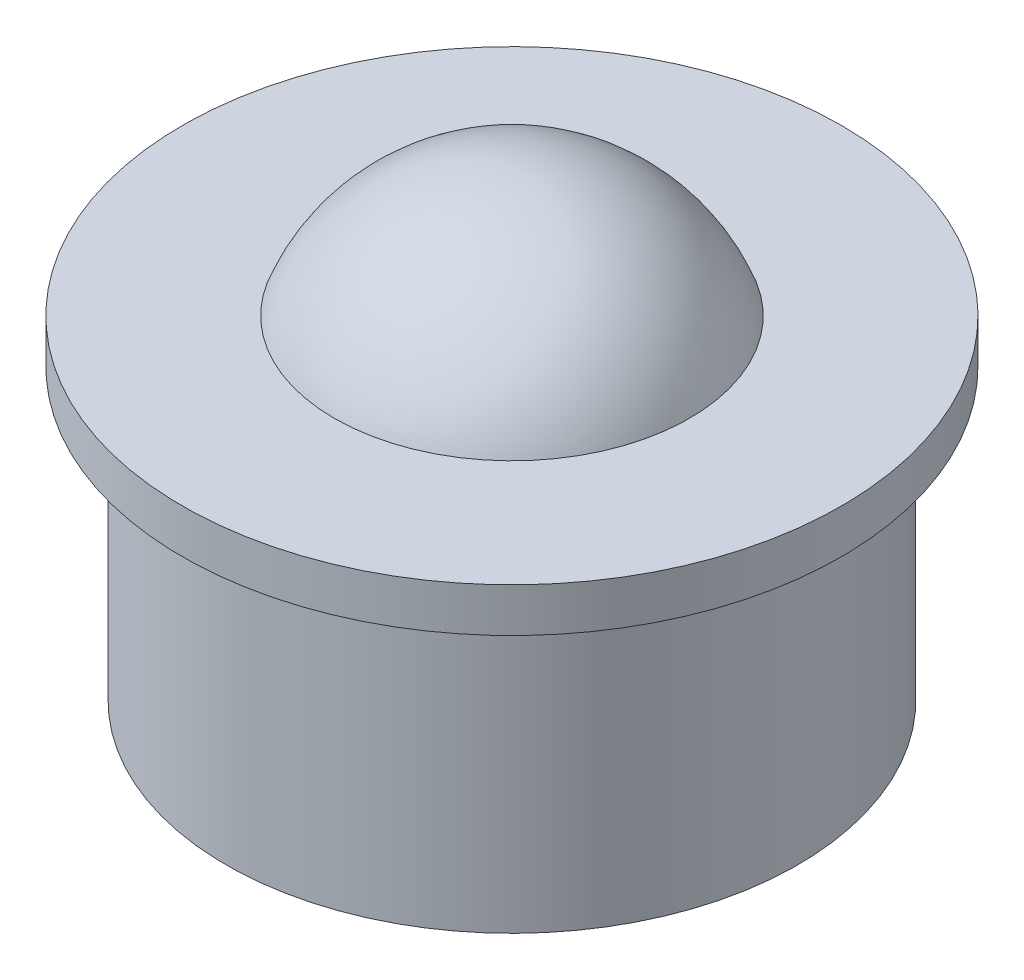
from build123d import *


with BuildPart() as part:
    # 草图1 → 旋转2 (revolve)
    with BuildSketch(Plane.XY):
        with BuildLine():
            Line((0, 4.32), (0, -4.32))
            ThreePointArc((0, -4.32), (4.32, 0), (0, 4.32))
        make_face()
    revolve(axis=Axis((0, 0, 0), (0, 1, 0)))

    # 草图2 → 旋转3 (revolve)
    with BuildSketch(Plane.XY, mode=Mode.PRIVATE) as revolve_3_sk:
        Polygon((0, 1.52), (7.5, 1.52), (7.5, 0.52), (6.5, 0.52), (6.5, -6.05604586), (0, -6.05604586), align=None)
    revolve(revolve_3_sk.sketch.rotate(Axis((0, -6.05604586, 0), (0, 1, 0)), 90), axis=Axis((0, -6.05604586, 0), (0, 1, 0)))


solid = part.part
